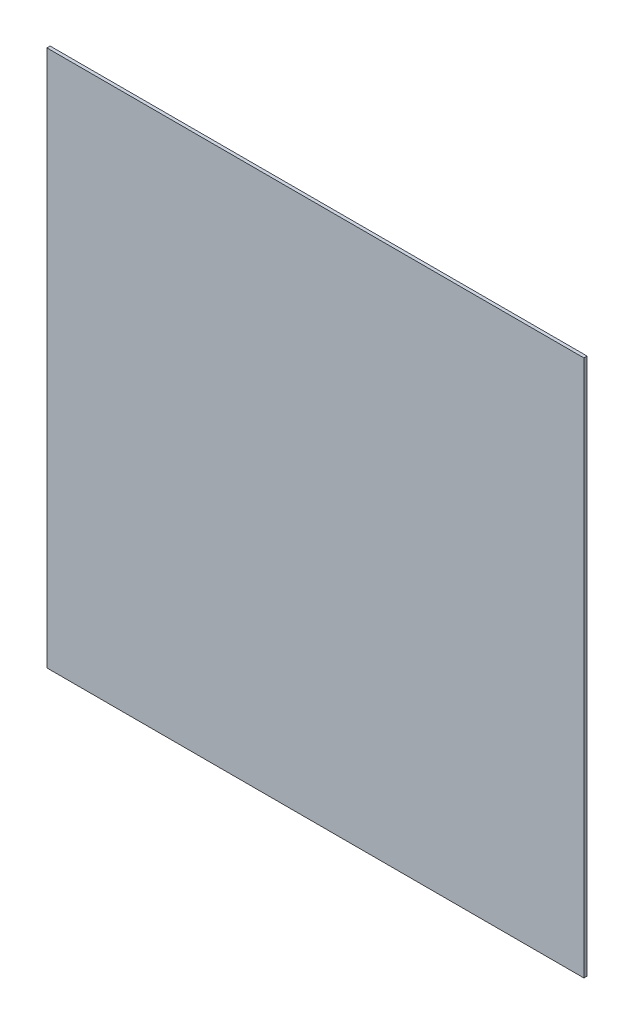
from build123d import *

# Parameters (mm, degrees)
ESBO_O2_W                = 500
ESBO_O2_H                = 500
RESSALTO_EXTRUS_O1_DEPTH = 3


with BuildPart() as part:
    # Esboço2 → Ressalto-extrusão1 (new body)
    with BuildSketch(Plane.XY):
        Rectangle(ESBO_O2_W, ESBO_O2_H)
    extrude(amount=RESSALTO_EXTRUS_O1_DEPTH)


solid = part.part
